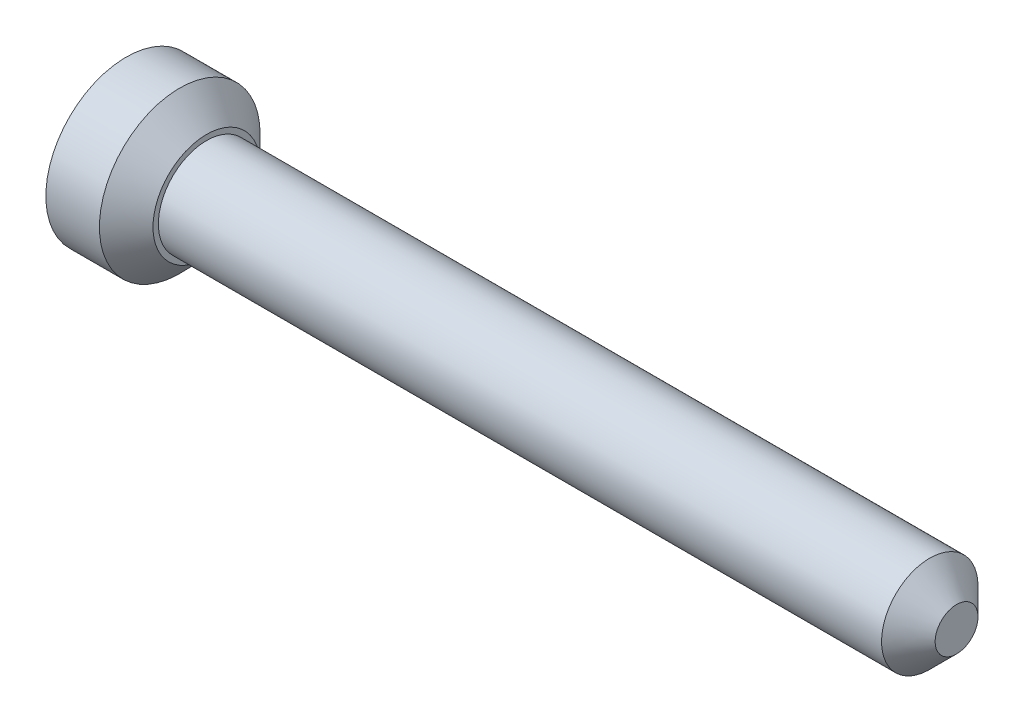
from build123d import *

# Parameters (mm, degrees)
SKETCH1_R           = 0.9
BOSS_EXTRUDE1_DEPTH = 14
SKETCH2_R           = 1.5
BOSS_EXTRUDE2_DEPTH = 1.5
CHAMFER1_SIZE       = 0.5


with BuildPart() as part:
    # Sketch1 → Boss-Extrude1 (new body)
    with BuildSketch(Plane(origin=(0, 0, 0), x_dir=(0, 0, -1), z_dir=(1, 0, 0))):
        Circle(SKETCH1_R)
    extrude(amount=BOSS_EXTRUDE1_DEPTH)

    # Sketch2 → Boss-Extrude2 (add)
    with BuildSketch(Plane(origin=(0, 0, 0), x_dir=(0, 0, -1), z_dir=(1, 0, 0))):
        Circle(SKETCH2_R)
    extrude(amount=-BOSS_EXTRUDE2_DEPTH)

    # Chamfer1
    chamfer1_edges = [part.edges().sort_by_distance(p)[0] for p in [
        (14, 0, 0.9),
        (0, 0, 1.5),
    ]]
    chamfer(chamfer1_edges, length=CHAMFER1_SIZE)


solid = part.part
